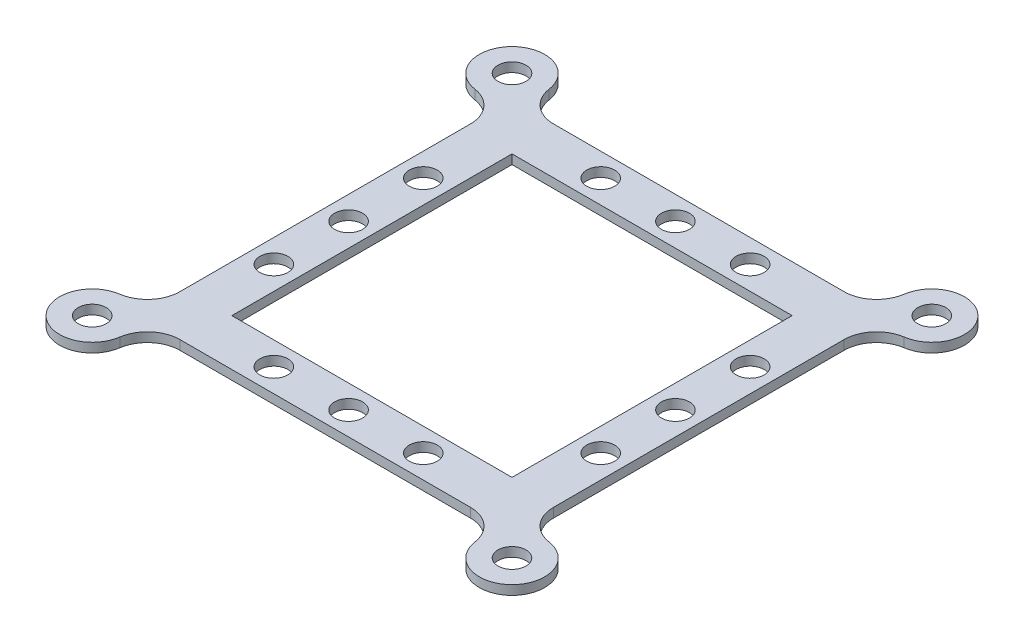
from build123d import *

# Parameters (mm, degrees)
CROQUIS1_R              = 1.5
CROQUIS1_W              = 30
CROQUIS1_H              = 30
SALIENTE_EXTRUIR1_DEPTH = 1


with BuildPart() as part:
    # Croquis1 → Saliente-Extruir1 (new body)
    with BuildSketch(Plane(origin=(0, 0, 0), x_dir=(1, 0, 0), z_dir=(0, 1, 0))):
        with BuildLine():
            Line((-5, 30.550343704), (-5, -0.550343704))
            ThreePointArc((-5, -0.550343704), (-5.850097081, -2.836828892), (-7.987436867, -4.012608719))
            ThreePointArc((-7.987436867, -4.012608719), (-9.949747468, -9.949747468), (-4.012608719, -7.987436867))
            ThreePointArc((-4.012608719, -7.987436867), (-2.836828892, -5.850097081), (-0.550343704, -5))
            Line((-0.550343704, -5), (30.550343704, -5))
            ThreePointArc((30.550343704, -5), (32.836828892, -5.850097081), (34.012608719, -7.987436867))
            ThreePointArc((34.012608719, -7.987436867), (39.949747468, -9.949747468), (37.987436867, -4.012608719))
            ThreePointArc((37.987436867, -4.012608719), (35.850097081, -2.836828892), (35, -0.550343704))
            Line((35, -0.550343704), (35, 30.550343704))
            ThreePointArc((35, 30.550343704), (35.850097081, 32.836828892), (37.987436867, 34.012608719))
            ThreePointArc((37.987436867, 34.012608719), (39.949747468, 39.949747468), (34.012608719, 37.987436867))
            ThreePointArc((34.012608719, 37.987436867), (32.836828892, 35.850097081), (30.550343704, 35))
            Line((30.550343704, 35), (-0.550343704, 35))
            ThreePointArc((-0.550343704, 35), (-2.836828892, 35.850097081), (-4.012608719, 37.987436867))
            ThreePointArc((-4.012608719, 37.987436867), (-9.949747468, 39.949747468), (-7.987436867, 34.012608719))
            ThreePointArc((-7.987436867, 34.012608719), (-5.850097081, 32.836828892), (-5, 30.550343704))
        make_face()
        with Locations(Location((7, -2.5, 0), (0, 0, 270))):
            Circle(CROQUIS1_R, mode=Mode.SUBTRACT)
        with Locations(Location((15, -2.5, 0), (0, 0, 270))):
            Circle(CROQUIS1_R, mode=Mode.SUBTRACT)
        with Locations(Location((-2.5, 7, 0), (0, 0, 270))):
            Circle(CROQUIS1_R, mode=Mode.SUBTRACT)
        with Locations((15, 15)):
            Rectangle(CROQUIS1_W, CROQUIS1_H, mode=Mode.SUBTRACT)
        with Locations(Location((23, -2.5, 0), (0, 0, 270))):
            Circle(CROQUIS1_R, mode=Mode.SUBTRACT)
        with Locations(Location((32.5, 7, 0), (0, 0, 270))):
            Circle(CROQUIS1_R, mode=Mode.SUBTRACT)
        with Locations(Location((32.5, 15, 0), (0, 0, 270))):
            Circle(CROQUIS1_R, mode=Mode.SUBTRACT)
        with Locations(Location((-2.5, 15, 0), (0, 0, 270))):
            Circle(CROQUIS1_R, mode=Mode.SUBTRACT)
        with Locations(Location((-2.5, 23, 0), (0, 0, 270))):
            Circle(CROQUIS1_R, mode=Mode.SUBTRACT)
        with Locations(Location((-7.474873734, 37.474873734, 0), (0, 0, 270))):
            Circle(CROQUIS1_R, mode=Mode.SUBTRACT)
        with Locations(Location((7, 32.5, 0), (0, 0, 270))):
            Circle(CROQUIS1_R, mode=Mode.SUBTRACT)
        with Locations(Location((32.5, 23, 0), (0, 0, 270))):
            Circle(CROQUIS1_R, mode=Mode.SUBTRACT)
        with Locations(Location((15, 32.5, 0), (0, 0, 270))):
            Circle(CROQUIS1_R, mode=Mode.SUBTRACT)
        with Locations(Location((23, 32.5, 0), (0, 0, 270))):
            Circle(CROQUIS1_R, mode=Mode.SUBTRACT)
        with Locations(Location((-7.474873734, -7.474873734, 0), (0, 0, 270))):
            Circle(CROQUIS1_R, mode=Mode.SUBTRACT)
        with Locations(Location((37.474873734, -7.474873734, 0), (0, 0, 270))):
            Circle(CROQUIS1_R, mode=Mode.SUBTRACT)
        with Locations(Location((37.474873734, 37.474873734, 0), (0, 0, 270))):
            Circle(CROQUIS1_R, mode=Mode.SUBTRACT)
    extrude(amount=SALIENTE_EXTRUIR1_DEPTH)


solid = part.part
